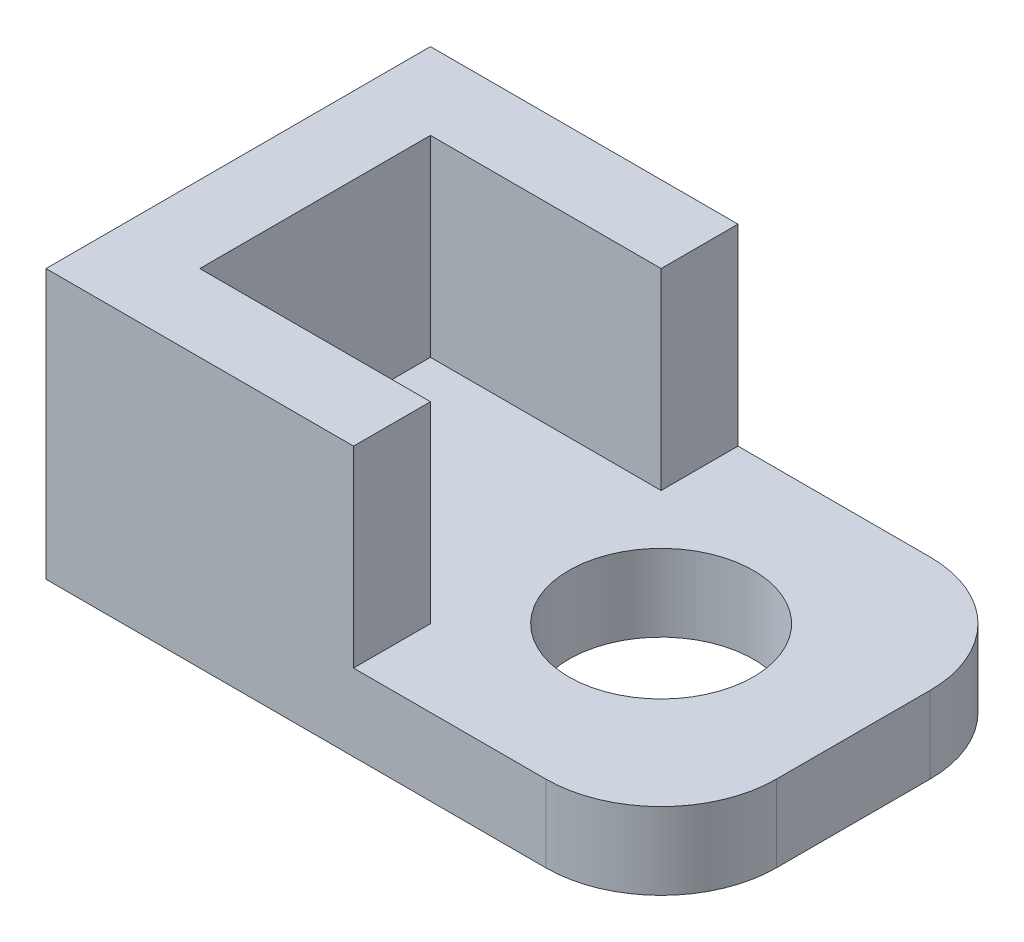
from build123d import *

# Parameters (mm, degrees)
SKETCH1_R           = 12
BOSS_EXTRUDE1_DEPTH = 10
BOSS_EXTRUDE2_DEPTH = 35
FILLET1_R           = 15


with BuildPart() as part:
    # Sketch1 → Boss-Extrude1 (new body)
    with BuildSketch(Plane(origin=(0, 0, 0), x_dir=(1, 0, 0), z_dir=(0, 1, 0))):
        Polygon((40, 25), (0, 25), (0, 15), (-30, 15), (-30, -15), (0, -15), (0, -25), (40, -25), align=None)
        with Locations((15, 0)):
            Circle(SKETCH1_R, mode=Mode.SUBTRACT)
    extrude(amount=BOSS_EXTRUDE1_DEPTH)

    # Sketch1<3> → Boss-Extrude2 (add)
    with BuildSketch(Plane(origin=(0, 0, 0), x_dir=(1, 0, 0), z_dir=(0, 1, 0))):
        Polygon((0, 15), (0, 25), (-40, 25), (-40, -25), (0, -25), (0, -15), (-30, -15), (-30, 15), align=None)
    extrude(amount=BOSS_EXTRUDE2_DEPTH)

    # Fillet1
    fillet1_edges = [part.edges().sort_by_distance(p)[0] for p in [
        (40, 5, -25),
        (40, 5, 25),
    ]]
    fillet(fillet1_edges, radius=FILLET1_R)


solid = part.part
